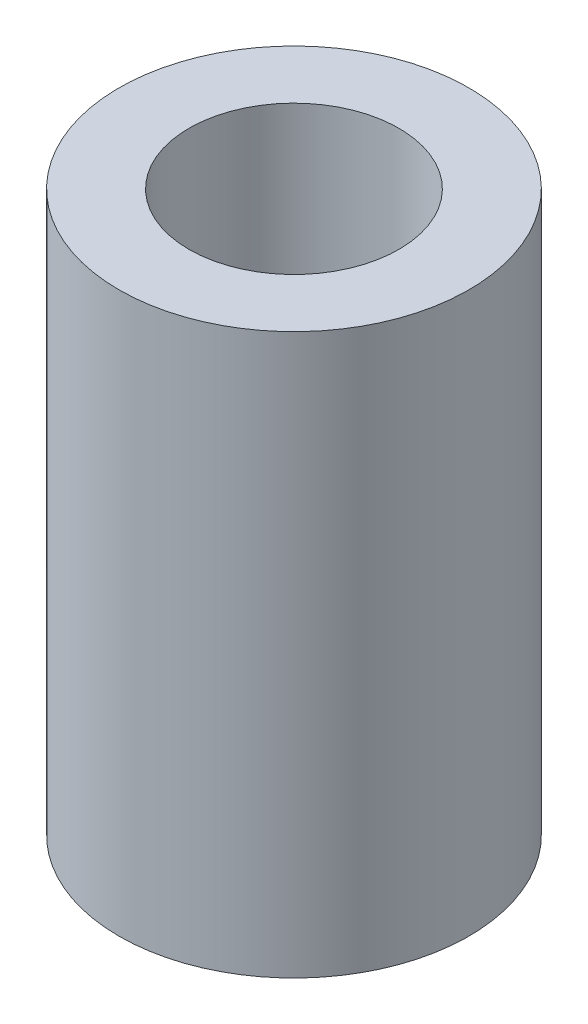
from build123d import *

# Parameters (mm, degrees)
SKETCH_1_R      = 2.5
SKETCH_1_R_2    = 1.5
EXTRUDE_1_DEPTH = 8


with BuildPart() as part:
    # 草图1 → 凸台-拉伸1 (new body)
    with BuildSketch(Plane(origin=(0, 0, 0), x_dir=(1, 0, 0), z_dir=(0, 1, 0))):
        with Locations(Location((0, 0, 0), (0, 0, 270))):
            Circle(SKETCH_1_R)
        with Locations(Location((0, 0, 0), (0, 0, 270))):
            Circle(SKETCH_1_R_2, mode=Mode.SUBTRACT)
    extrude(amount=EXTRUDE_1_DEPTH)


solid = part.part
